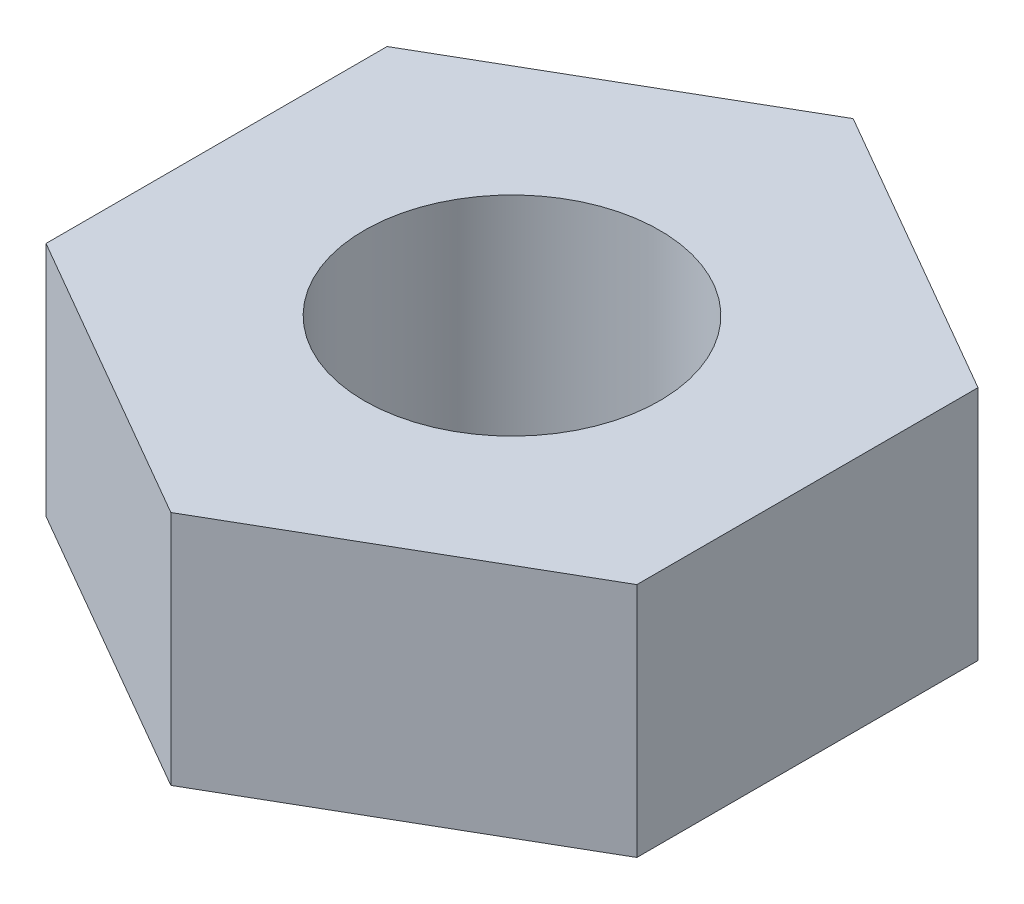
from build123d import *

# Parameters (mm, degrees)
SKETCH_1_R      = 1
EXTRUDE_1_DEPTH = 1.6


with BuildPart() as part:
    # 草图1 → 凸台-拉伸1 (new body)
    with BuildSketch(Plane(origin=(0, 0, 0), x_dir=(1, 0, 0), z_dir=(0, 1, 0))):
        Polygon((0, -2.309401077), (2, -1.154700538), (2, 1.154700538), (0, 2.309401077), (-2, 1.154700538), (-2, -1.154700538), align=None)
        with Locations(Location((0, 0, 0), (0, 0, 270))):
            Circle(SKETCH_1_R, mode=Mode.SUBTRACT)
    extrude(amount=EXTRUDE_1_DEPTH)


solid = part.part
